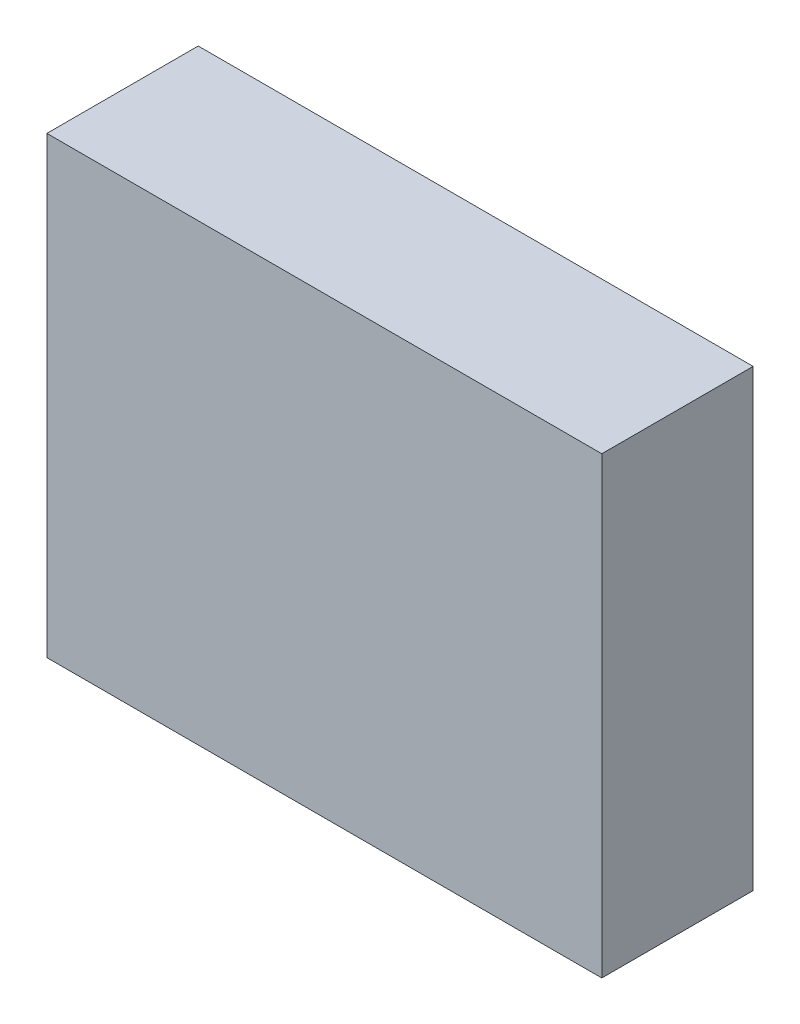
from build123d import *

# Parameters (mm, degrees)
STORE_PANO_ROLE_KARTI_2_8KANAL_1_START = -670
SKETCH1_W                              = 110
SKETCH1_H                              = 90
STORE_PANO_ROLE_KARTI_2_8KANAL_1_DEPTH = 30


with BuildPart() as part:
    # Sketch1 → STORE_pano_role_karti_2_8kanal_1 (new body)
    with BuildSketch(Plane.XY.offset(STORE_PANO_ROLE_KARTI_2_8KANAL_1_START)):
        with Locations((1175, 1735)):
            Rectangle(SKETCH1_W, SKETCH1_H)
    extrude(amount=-STORE_PANO_ROLE_KARTI_2_8KANAL_1_DEPTH)


solid = part.part
